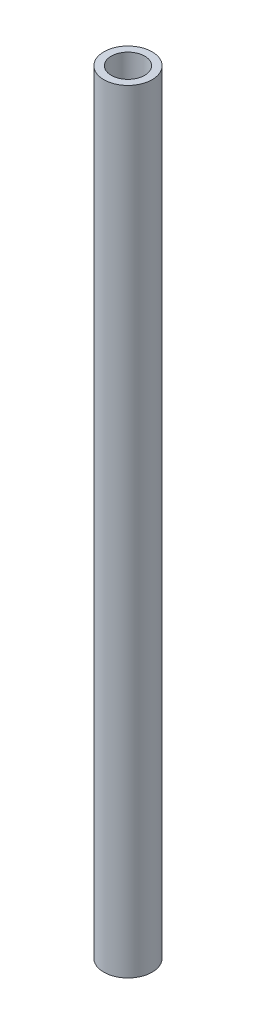
from build123d import *

# Parameters (mm, degrees)
SKETCH1_R                   = 3.175
BOSS_EXTRUDE1_DEPTH         = 101.6
TAP_DRILL_FOR_8_HELICOIL1_D = 4.3942


with BuildPart() as part:
    # Sketch1 → Boss-Extrude1 (new body)
    with BuildSketch(Plane(origin=(0, 0, 0), x_dir=(1, 0, 0), z_dir=(0, 1, 0))):
        with Locations(Location((0, 0, 0), (0, 0, 270))):
            Circle(SKETCH1_R)
    extrude(amount=BOSS_EXTRUDE1_DEPTH)

    # Tap Drill for #8 Helicoil1 (through all)
    with Locations(Plane(origin=(0, 101.6, 0), x_dir=(1, 0, 0), z_dir=(0, 1, 0))):
        with Locations((0, 0)):
            Hole(TAP_DRILL_FOR_8_HELICOIL1_D / 2)


solid = part.part
